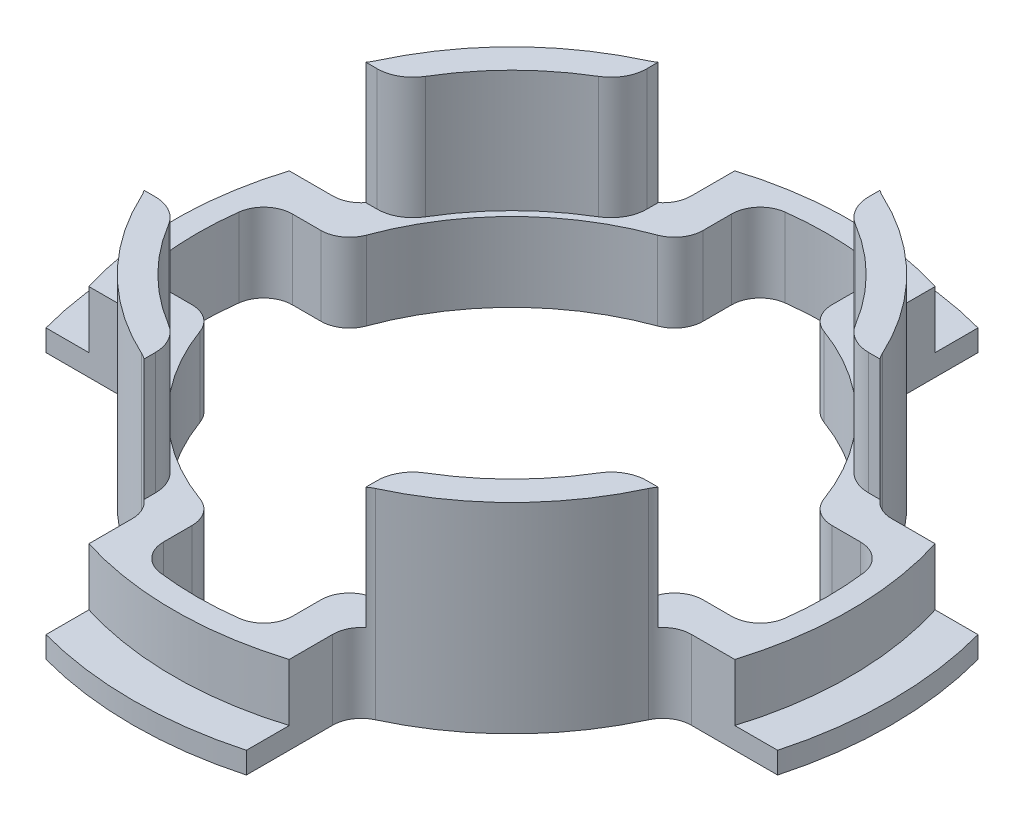
from build123d import *

# Parameters (mm, degrees)
SKETCH_1_R          = 3.4
EXTRUDE_1_DEPTH     = 1.1
EXTRUDE_START       = -0.362295
EXTRUDE_2_DEPTH     = 1.1
EXTRUDE_START_2     = -1.1
EXTRUDE_3_DEPTH     = 0.3
EXTRUDE_START_3     = 1.1
EXTRUDE_4_DEPTH     = 1.7
FILLET_2_R          = 0.5
FILLET_3_R          = 0.4
CUT_EXTRUDE_1_DEPTH = 8.685701009
FILLET_5_R          = 0.4


with BuildPart() as part:
    # 草图1 → 凸台-拉伸1 (new body)
    with BuildSketch(Plane.XZ.offset(4.897705057)):
        with BuildLine():
            Line((1.4, 4.38178046), (1.4, 3.640054945))
            ThreePointArc((1.4, 3.640054945), (2.757716447, 2.757716447), (3.640054945, 1.4))
            Line((3.640054945, 1.4), (4.38178046, 1.4))
            ThreePointArc((4.38178046, 1.4), (4.6, 0), (4.38178046, -1.4))
            Line((4.38178046, -1.4), (3.640054945, -1.4))
            ThreePointArc((3.640054945, -1.4), (2.757716447, -2.757716447), (1.4, -3.640054945))
            Line((1.4, -3.640054945), (1.4, -4.38178046))
            ThreePointArc((1.4, -4.38178046), (0, -4.6), (-1.4, -4.38178046))
            Line((-1.4, -4.38178046), (-1.4, -3.640054945))
            ThreePointArc((-1.4, -3.640054945), (-2.757716447, -2.757716447), (-3.640054945, -1.4))
            Line((-3.640054945, -1.4), (-4.38178046, -1.4))
            ThreePointArc((-4.38178046, -1.4), (-4.6, 0), (-4.38178046, 1.4))
            Line((-4.38178046, 1.4), (-3.640054945, 1.4))
            ThreePointArc((-3.640054945, 1.4), (-2.757716447, 2.757716447), (-1.4, 3.640054945))
            Line((-1.4, 3.640054945), (-1.4, 4.38178046))
            ThreePointArc((-1.4, 4.38178046), (0, 4.6), (1.4, 4.38178046))
        make_face()
        with Locations(Location((0, 0, 0), (0, 0, 270))):
            Circle(SKETCH_1_R, mode=Mode.SUBTRACT)
    extrude(amount=-EXTRUDE_1_DEPTH)

    # 草图2 → 凸台-拉伸2 (add)
    with BuildSketch(Plane.XZ.offset(4.16).offset(EXTRUDE_START)):
        with BuildLine():
            Line((4.276680956, 1.4), (4.512828935, 1.4))
            ThreePointArc((4.512828935, 1.4), (4.725, 0), (4.512828935, -1.4))
            Line((4.512828935, -1.4), (4.276680956, -1.4))
            ThreePointArc((4.276680956, -1.4), (4.5, 0), (4.276680956, 1.4))
        make_face()
        with BuildLine():
            Line((1.4, -4.276680956), (1.4, -4.512828935))
            ThreePointArc((1.4, -4.512828935), (0, -4.725), (-1.4, -4.512828935))
            Line((-1.4, -4.512828935), (-1.4, -4.276680956))
            ThreePointArc((-1.4, -4.276680956), (0, -4.5), (1.4, -4.276680956))
        make_face()
        with BuildLine():
            Line((-4.276680956, -1.4), (-4.512828935, -1.4))
            ThreePointArc((-4.512828935, -1.4), (-4.725, 0), (-4.512828935, 1.4))
            Line((-4.512828935, 1.4), (-4.276680956, 1.4))
            ThreePointArc((-4.276680956, 1.4), (-4.5, 0), (-4.276680956, -1.4))
        make_face()
        with BuildLine():
            Line((-1.4, 4.276680956), (-1.4, 4.512828935))
            ThreePointArc((-1.4, 4.512828935), (0, 4.725), (1.4, 4.512828935))
            Line((1.4, 4.512828935), (1.4, 4.276680956))
            ThreePointArc((1.4, 4.276680956), (0, 4.5), (-1.4, 4.276680956))
        make_face()
    extrude(amount=EXTRUDE_2_DEPTH)

    # 草图3 → 凸台-拉伸3 (add)
    with BuildSketch(Plane(origin=(0, -3.797705057, 0), x_dir=(-1, 0, 0), z_dir=(0, 1, 0)).offset(EXTRUDE_START_2)):
        with BuildLine():
            Line((4.276680956, 1.4), (5.111751168, 1.4))
            ThreePointArc((5.111751168, 1.4), (5.3, 0), (5.111751168, -1.4))
            Line((5.111751168, -1.4), (4.276680956, -1.4))
            ThreePointArc((4.276680956, -1.4), (4.5, 0), (4.276680956, 1.4))
        make_face()
        with BuildLine():
            Line((-1.4, -4.276680956), (-1.4, -5.111751168))
            ThreePointArc((-1.4, -5.111751168), (0, -5.3), (1.4, -5.111751168))
            Line((1.4, -5.111751168), (1.4, -4.276680956))
            ThreePointArc((1.4, -4.276680956), (0, -4.5), (-1.4, -4.276680956))
        make_face()
        with BuildLine():
            Line((-4.276680956, 1.4), (-5.111751168, 1.4))
            ThreePointArc((-5.111751168, 1.4), (-5.3, 0), (-5.111751168, -1.4))
            Line((-5.111751168, -1.4), (-4.276680956, -1.4))
            ThreePointArc((-4.276680956, -1.4), (-4.5, 0), (-4.276680956, 1.4))
        make_face()
        with BuildLine():
            Line((1.4, 4.276680956), (1.4, 5.111751168))
            ThreePointArc((1.4, 5.111751168), (0, 5.3), (-1.4, 5.111751168))
            Line((-1.4, 5.111751168), (-1.4, 4.276680956))
            ThreePointArc((-1.4, 4.276680956), (0, 4.5), (1.4, 4.276680956))
        make_face()
    extrude(amount=EXTRUDE_3_DEPTH)

    # 草图4 → 凸台-拉伸4 (add)
    with BuildSketch(Plane(origin=(0, -4.897705057, 0), x_dir=(-1, 0, 0), z_dir=(0, 1, 0)).offset(EXTRUDE_START_3)):
        with BuildLine():
            Line((1.55, 3.578756767), (1.55, 3.138072657))
            ThreePointArc((1.55, 3.138072657), (2.474873734, 2.474873734), (3.138072657, 1.55))
            Line((3.138072657, 1.55), (3.578756767, 1.55))
            ThreePointArc((3.578756767, 1.55), (2.757716447, 2.757716447), (1.55, 3.578756767))
        make_face()
        with BuildLine():
            Line((1.55, -3.138072657), (1.55, -3.578756767))
            ThreePointArc((1.55, -3.578756767), (2.757716447, -2.757716447), (3.578756767, -1.55))
            Line((3.578756767, -1.55), (3.138072657, -1.55))
            ThreePointArc((3.138072657, -1.55), (2.474873734, -2.474873734), (1.55, -3.138072657))
        make_face()
        with BuildLine():
            Line((-3.138072657, -1.55), (-3.578756767, -1.55))
            ThreePointArc((-3.578756767, -1.55), (-2.757716447, -2.757716447), (-1.55, -3.578756767))
            Line((-1.55, -3.578756767), (-1.55, -3.138072657))
            ThreePointArc((-1.55, -3.138072657), (-2.474873734, -2.474873734), (-3.138072657, -1.55))
        make_face()
        with BuildLine():
            Line((-1.55, 3.138072657), (-1.55, 3.578756767))
            ThreePointArc((-1.55, 3.578756767), (-2.757716447, 2.757716447), (-3.578756767, 1.55))
            Line((-3.578756767, 1.55), (-3.138072657, 1.55))
            ThreePointArc((-3.138072657, 1.55), (-2.474873734, 2.474873734), (-1.55, 3.138072657))
        make_face()
    extrude(amount=EXTRUDE_4_DEPTH)

    # 圆角2
    fillet_2_edges = [part.edges().sort_by_distance(p)[0] for p in [
        (1.55, -2.947705057, 3.138072657),
        (3.138072657, -2.947705057, 1.55),
        (3.138072657, -2.947705057, -1.55),
        (1.55, -2.947705057, -3.138072657),
        (-1.55, -2.947705057, -3.138072657),
        (-3.138072657, -2.947705057, -1.55),
        (-3.138072657, -2.947705057, 1.55),
        (-1.55, -2.947705057, 3.138072657),
    ]]
    fillet(fillet_2_edges, radius=FILLET_2_R)

    # 圆角3
    fillet_3_edges = [part.edges().sort_by_distance(p)[0] for p in [
        (-3.640054945, -4.347705057, 1.4),
        (-3.640054945, -4.347705057, -1.4),
        (-1.4, -4.347705057, -3.640054945),
        (1.4, -4.347705057, -3.640054945),
        (3.640054945, -4.347705057, -1.4),
        (3.640054945, -4.347705057, 1.4),
        (1.4, -4.347705057, 3.640054945),
        (-1.4, -4.347705057, 3.640054945),
    ]]
    fillet(fillet_3_edges, radius=FILLET_3_R)

    # 草图5 → 切除-拉伸1 (cut, through all)
    with BuildSketch(Plane(origin=(0, -3.797705057, 0), x_dir=(-1, 0, 0), z_dir=(0, 1, 0))):
        with BuildLine():
            Line((4.306971093, 0.9), (2.740001738, 0.9))
            Line((2.740001738, 0.9), (2.740001738, -0.9))
            Line((2.740001738, -0.9), (4.306971093, -0.9))
            ThreePointArc((4.306971093, -0.9), (4.4, 0), (4.306971093, 0.9))
        make_face()
        with BuildLine():
            Line((0.9, -4.306971093), (0.9, -2.740001738))
            Line((0.9, -2.740001738), (-0.9, -2.740001738))
            Line((-0.9, -2.740001738), (-0.9, -4.306971093))
            ThreePointArc((-0.9, -4.306971093), (0, -4.4), (0.9, -4.306971093))
        make_face()
        with BuildLine():
            Line((-4.306971093, -0.9), (-2.740001738, -0.9))
            Line((-2.740001738, -0.9), (-2.740001738, 0.9))
            Line((-2.740001738, 0.9), (-4.306971093, 0.9))
            ThreePointArc((-4.306971093, 0.9), (-4.4, 0), (-4.306971093, -0.9))
        make_face()
        with BuildLine():
            Line((-0.9, 4.306971093), (-0.9, 2.740001738))
            Line((-0.9, 2.740001738), (0.9, 2.740001738))
            Line((0.9, 2.740001738), (0.9, 4.306971093))
            ThreePointArc((0.9, 4.306971093), (0, 4.4), (-0.9, 4.306971093))
        make_face()
    extrude(amount=-CUT_EXTRUDE_1_DEPTH, mode=Mode.SUBTRACT)

    # 圆角5
    fillet_5_edges = [part.edges().sort_by_distance(p)[0] for p in [
        (0.9, -4.347705057, 3.278719262),
        (-0.9, -4.347705057, 3.278719262),
        (3.278719262, -4.347705057, -0.9),
        (3.278719262, -4.347705057, 0.9),
        (-0.9, -4.347705057, -3.278719262),
        (0.9, -4.347705057, -3.278719262),
        (-3.278719262, -4.347705057, 0.9),
        (-3.278719262, -4.347705057, -0.9),
        (-4.306971093, -4.347705057, -0.9),
        (-4.306971093, -4.347705057, 0.9),
        (0.9, -4.347705057, -4.306971093),
        (-0.9, -4.347705057, -4.306971093),
        (4.306971093, -4.347705057, 0.9),
        (4.306971093, -4.347705057, -0.9),
        (-0.9, -4.347705057, 4.306971093),
        (0.9, -4.347705057, 4.306971093),
    ]]
    fillet(fillet_5_edges, radius=FILLET_5_R)


solid = part.part
